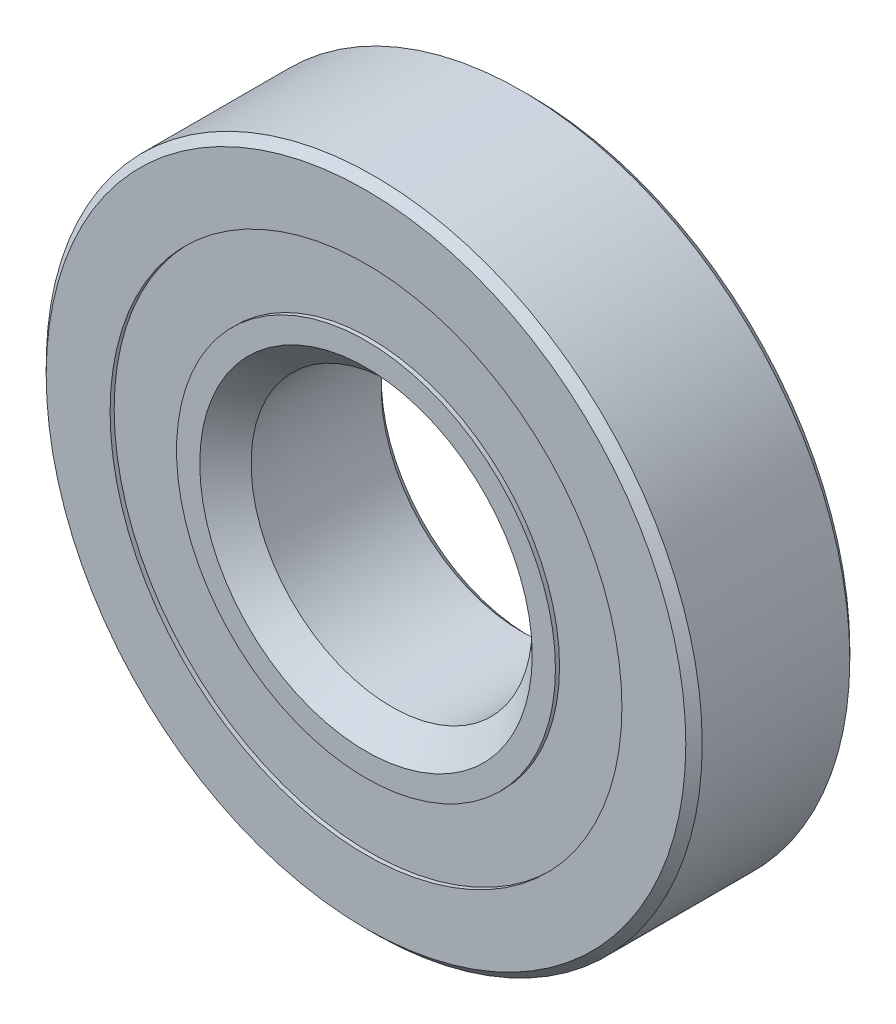
from build123d import *

# Parameters (mm, degrees)
CIRPATTERN1_COUNT = 12
SKETCH5_W         = 1.203469126
SKETCH5_H         = 2.251725868


with BuildPart() as part:
    # Sketch1 → Revolve1 (revolve)
    with BuildSketch(Plane(origin=(0, 0, 0), x_dir=(0, 0, -1), z_dir=(1, 0, 0))):
        with BuildLine():
            Line((2.5003125, 11.1125), (-2.5003125, 11.1125))
            Line((-2.5003125, 11.1125), (-2.778125, 10.8346875))
            Line((-2.778125, 10.8346875), (-2.778125, 8.670192308))
            Line((-2.778125, 8.670192308), (-1.234722222, 8.670192308))
            ThreePointArc((-1.234722222, 8.670192308), (0, 9.373249624), (1.234722222, 8.670192308))
            Line((1.234722222, 8.670192308), (2.778125, 8.670192308))
            Line((2.778125, 8.670192308), (2.778125, 10.8346875))
            Line((2.778125, 10.8346875), (2.5003125, 11.1125))
        make_face()
    revolve(axis=Axis((0, 0, 2.778125), (0, 0, -1)))


with BuildPart() as body_2:
    # Sketch3 → Revolve3 (revolve)
    with BuildSketch(Plane(origin=(0, 0, 0), x_dir=(0, 0, -1), z_dir=(1, 0, 0))):
        with BuildLine():
            Line((-2.63921875, 6.27956019), (-1.991783748, 5.632125188))
            Line((-1.991783748, 5.632125188), (0, 5.632125188))
            Line((0, 5.632125188), (0, 6.501750376))
            ThreePointArc((0, 6.501750376), (0.710427434, 6.689834242), (1.234722222, 7.204807692))
            Line((1.234722222, 7.204807692), (2.778125, 7.204807692))
            Line((2.778125, 7.204807692), (2.778125, 5.0403125))
            Line((2.778125, 5.0403125), (2.5003125, 4.7625))
            Line((2.5003125, 4.7625), (-1.908499812, 4.7625))
            Line((-1.908499812, 4.7625), (-2.778125, 5.632125188))
            Line((-2.778125, 5.632125188), (-2.778125, 6.41846644))
            Line((-2.778125, 6.41846644), (-2.63921875, 6.41846644))
            Line((-2.63921875, 6.41846644), (-2.63921875, 6.27956019))
        make_face()
    revolve(axis=Axis((0, 0, 2.778125), (0, 0, -1)))


with BuildPart() as body_3:
    # Sketch4 → Revolve4 (revolve)
    with BuildSketch(Plane(origin=(0, 0, 0), x_dir=(0, 0, -1), z_dir=(1, 0, 0))):
        with BuildLine():
            Line((-1.435749624, 7.9375), (1.435749624, 7.9375))
            ThreePointArc((1.435749624, 7.9375), (0, 9.373249624), (-1.435749624, 7.9375))
        make_face()
    revolve(axis=Axis((0, 7.9375, 1.435749624), (0, 0, -1)))


with BuildPart() as cirpattern1_1:
    # CirPattern1: pattern copy
    add(body_3.part.rotate(Axis((0, 0, -2.778125), (0, 0, 1)), 1 * 360 / CIRPATTERN1_COUNT))


with BuildPart() as cirpattern1_2:
    # CirPattern1: pattern copy
    add(body_3.part.rotate(Axis((0, 0, -2.778125), (0, 0, 1)), 2 * 360 / CIRPATTERN1_COUNT))


with BuildPart() as cirpattern1_3:
    # CirPattern1: pattern copy
    add(body_3.part.rotate(Axis((0, 0, -2.778125), (0, 0, 1)), 3 * 360 / CIRPATTERN1_COUNT))


with BuildPart() as cirpattern1_4:
    # CirPattern1: pattern copy
    add(body_3.part.rotate(Axis((0, 0, -2.778125), (0, 0, 1)), 4 * 360 / CIRPATTERN1_COUNT))


with BuildPart() as cirpattern1_5:
    # CirPattern1: pattern copy
    add(body_3.part.rotate(Axis((0, 0, -2.778125), (0, 0, 1)), 5 * 360 / CIRPATTERN1_COUNT))


with BuildPart() as cirpattern1_6:
    # CirPattern1: pattern copy
    add(body_3.part.rotate(Axis((0, 0, -2.778125), (0, 0, 1)), 6 * 360 / CIRPATTERN1_COUNT))


with BuildPart() as cirpattern1_7:
    # CirPattern1: pattern copy
    add(body_3.part.rotate(Axis((0, 0, -2.778125), (0, 0, 1)), 7 * 360 / CIRPATTERN1_COUNT))


with BuildPart() as cirpattern1_8:
    # CirPattern1: pattern copy
    add(body_3.part.rotate(Axis((0, 0, -2.778125), (0, 0, 1)), 8 * 360 / CIRPATTERN1_COUNT))


with BuildPart() as cirpattern1_9:
    # CirPattern1: pattern copy
    add(body_3.part.rotate(Axis((0, 0, -2.778125), (0, 0, 1)), 9 * 360 / CIRPATTERN1_COUNT))


with BuildPart() as cirpattern1_10:
    # CirPattern1: pattern copy
    add(body_3.part.rotate(Axis((0, 0, -2.778125), (0, 0, 1)), 10 * 360 / CIRPATTERN1_COUNT))


with BuildPart() as cirpattern1_11:
    # CirPattern1: pattern copy
    add(body_3.part.rotate(Axis((0, 0, -2.778125), (0, 0, 1)), 11 * 360 / CIRPATTERN1_COUNT))


with BuildPart() as body_15:
    # Sketch5 → Revolve5 (revolve)
    with BuildSketch(Plane(origin=(0, 0, 0), x_dir=(0, 0, -1), z_dir=(1, 0, 0))):
        with Locations((-2.037484187, 7.544329374)):
            Rectangle(SKETCH5_W, SKETCH5_H)
        with Locations((2.037484187, 7.544329374)):
            Rectangle(SKETCH5_W, SKETCH5_H)
    revolve(axis=Axis((0, 0, 2.778125), (0, 0, -1)))


solid = Compound([part.part, body_2.part, body_3.part, cirpattern1_1.part, cirpattern1_2.part, cirpattern1_3.part, cirpattern1_4.part, cirpattern1_5.part, cirpattern1_6.part, cirpattern1_7.part, cirpattern1_8.part, cirpattern1_9.part, cirpattern1_10.part, cirpattern1_11.part, body_15.part])
